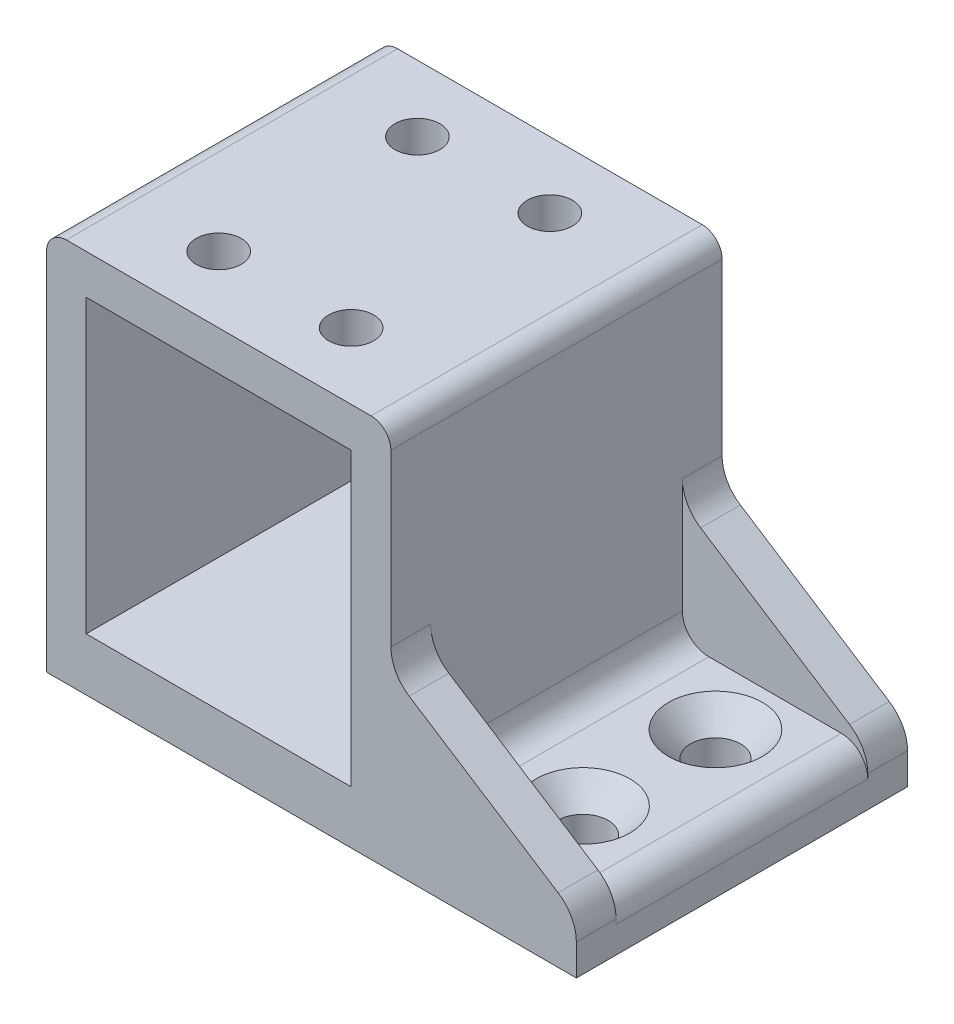
from build123d import *

# Parameters (mm, degrees)
PROFILE_SKETCH_W               = 20
PROFILE_SKETCH_H               = 22
PROFILE_EXTRUDE_DEPTH          = 25
GUSSET_1_EXTRUDE_DEPTH         = 3
GUSSET_START                   = 22
GUSSET_2_EXTRUDE_DEPTH         = 3
SOLENOID_MOUNTING_HOLES_D      = 3.4
SOLENOID_MOUNTING_HOLES_DEPTH  = 3
NO_6_MOUNTING_HOLES_AT_2_COUNT = 2
NO_6_MOUNTING_HOLES_AT_2_PITCH = 10
FILLET3_R                      = 3
FILLET4_R                      = 2
FILLET5_R                      = 3
FILLET6_R                      = 1.5


with BuildPart() as part:
    # Profile Sketch → Profile  Extrude (new body)
    with BuildSketch(Plane.XY):
        Polygon((0, 0), (0, 25), (-26, 25), (-26, -4), (14, -4), (14, 0), align=None)
        with Locations((-13, 11)):
            Rectangle(PROFILE_SKETCH_W, PROFILE_SKETCH_H, mode=Mode.SUBTRACT)
    extrude(amount=PROFILE_EXTRUDE_DEPTH)

    # Gusset Sketch → Gusset 1 Extrude (add)
    with BuildSketch(Plane.XY):
        Polygon((0, 0), (14, 0), (0, 9), align=None)
    extrude(amount=GUSSET_1_EXTRUDE_DEPTH)

    # Gusset Sketch<2> → Gusset 2 Extrude (add)
    with BuildSketch(Plane.XY.offset(GUSSET_START)):
        Polygon((0, 0), (14, 0), (0, 9), align=None)
    extrude(amount=GUSSET_2_EXTRUDE_DEPTH)

    # Solenoid Mounting Holes
    with Locations(Plane(origin=(-25, 25, 0), x_dir=(0, 0, -1), z_dir=(0, 1, 0))):
        with Locations((-5, -17), (-20, -17), (-20, -7), (-5, -7)):
            Hole(SOLENOID_MOUNTING_HOLES_D / 2, depth=SOLENOID_MOUNTING_HOLES_DEPTH)

    # No. 6 Mounting Holes Profile Sketch → No. 6 Mounting Holes (revolve, cut)
    with BuildSketch(Plane(origin=(7, 0, 17.5), x_dir=(0, 0, 1), z_dir=(1, 0, 0))):
        Polygon((0, 0), (0, 4), (1.89865, 4), (1.89865, 1.891953401), (3.5433, 0), align=None)
    no_6_mounting_holes = revolve(axis=Axis((7, 6.35, 17.5), (0, -1, 0)), mode=Mode.SUBTRACT)

    # No. 6 Mounting Holes at 2: No. 6 Mounting Holes ×2
    with Locations(*[(0, 0, -i * NO_6_MOUNTING_HOLES_AT_2_PITCH) for i in range(1, NO_6_MOUNTING_HOLES_AT_2_COUNT)]):
        add(no_6_mounting_holes, mode=Mode.SUBTRACT)

    # Fillet3
    fillet3_edges = [part.edges().sort_by_distance(p)[0] for p in [
        (0, 9, 1.5),
        (0, 9, 23.5),
    ]]
    fillet(fillet3_edges, radius=FILLET3_R)

    # Fillet4
    fillet4_edges = [part.edges().sort_by_distance(p)[0] for p in [
        (14, 0, 12.5),
        (0, 0, 12.5),
    ]]
    fillet(fillet4_edges, radius=FILLET4_R)

    # Fillet5
    fillet5_edges = [part.edges().sort_by_distance(p)[0] for p in [
        (14, 0, 23.5),
        (14, 0, 1.5),
    ]]
    fillet(fillet5_edges, radius=FILLET5_R)

    # Fillet6
    fillet6_edges = [part.edges().sort_by_distance(p)[0] for p in [
        (-26, 25, 12.5),
        (0, 25, 12.5),
    ]]
    fillet(fillet6_edges, radius=FILLET6_R)


solid = part.part
